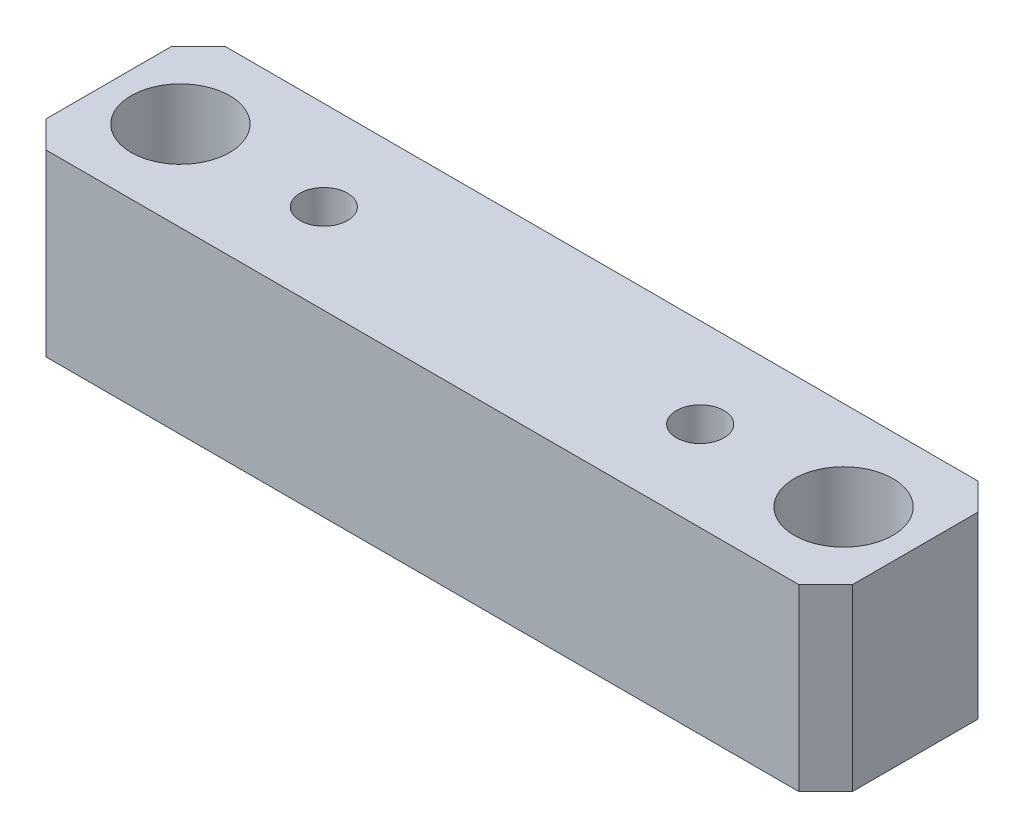
from build123d import *

# Parameters (mm, degrees)
SKETCH1_W           = 90
SKETCH1_H           = 20
SKETCH1_R           = 2.65
SKETCH1_R_2         = 2.75
BOSS_EXTRUDE1_DEPTH = 20
CUT_EXTRUDE1_DEPTH  = 12
SKETCH3_R           = 5.5
CUT_EXTRUDE2_DEPTH  = 14
CHAMFER1_SIZE       = 3


with BuildPart() as part:
    # Sketch1 → Boss-Extrude1 (new body)
    with BuildSketch(Plane(origin=(0, 0, 0), x_dir=(1, 0, 0), z_dir=(0, 1, 0))):
        Rectangle(SKETCH1_W, SKETCH1_H)
        with Locations(Location((-21, 0, 0), (0, 0, 270))):
            Circle(SKETCH1_R, mode=Mode.SUBTRACT)
        with Locations(Location((21, 0, 0), (0, 0, 270))):
            Circle(SKETCH1_R, mode=Mode.SUBTRACT)
        with Locations(Location((-37, 0, 0), (0, 0, 270))):
            Circle(SKETCH1_R_2, mode=Mode.SUBTRACT)
        with Locations(Location((37, 0, 0), (0, 0, 270))):
            Circle(SKETCH1_R_2, mode=Mode.SUBTRACT)
    extrude(amount=BOSS_EXTRUDE1_DEPTH)

    # Sketch2 → Cut-Extrude1 (cut)
    with BuildSketch(Plane.XZ):
        Polygon((-16.265727793, 0), (-18.632863896, 4.1), (-23.367136104, 4.1), (-25.734272207, 0), (-23.367136104, -4.1), (-18.632863896, -4.1), align=None)
        Polygon((25.734272207, 0), (23.367136104, 4.1), (18.632863896, 4.1), (16.265727793, 0), (18.632863896, -4.1), (23.367136104, -4.1), align=None)
    extrude(amount=-CUT_EXTRUDE1_DEPTH, mode=Mode.SUBTRACT)

    # Sketch3 → Cut-Extrude2 (cut)
    with BuildSketch(Plane(origin=(0, 20, 0), x_dir=(1, 0, 0), z_dir=(0, 1, 0))):
        with Locations(Location((-37, 0, 0), (0, 0, 270))):
            Circle(SKETCH3_R)
        with Locations(Location((37, 0, 0), (0, 0, 270))):
            Circle(SKETCH3_R)
    extrude(amount=-CUT_EXTRUDE2_DEPTH, mode=Mode.SUBTRACT)

    # Chamfer1
    chamfer1_edges = [part.edges().sort_by_distance(p)[0] for p in [
        (45, 10, 10),
        (-45, 10, 10),
        (-45, 10, -10),
        (45, 10, -10),
    ]]
    chamfer(chamfer1_edges, length=CHAMFER1_SIZE)


solid = part.part
